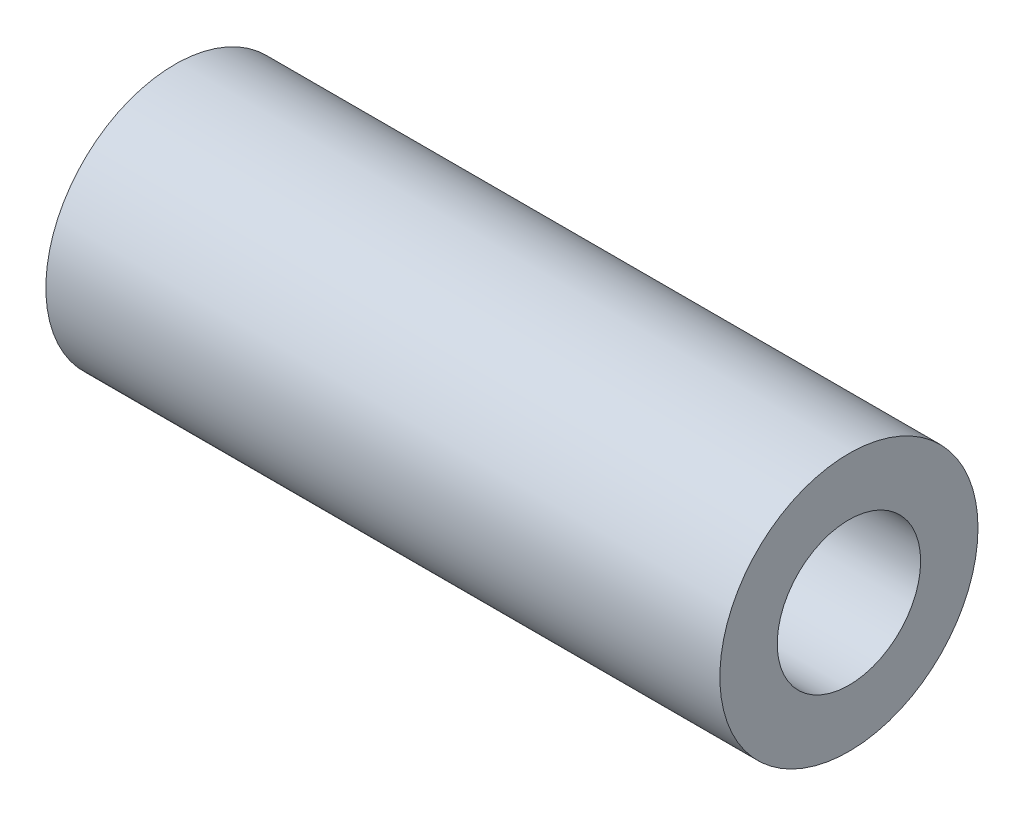
from build123d import *

# Parameters (mm, degrees)
SKETCH1_R           = 4.5
SKETCH1_R_2         = 2.5
BOSS_EXTRUDE1_DEPTH = 23.5


with BuildPart() as part:
    # Sketch1 → Boss-Extrude1 (new body)
    with BuildSketch(Plane(origin=(0, 0, 0), x_dir=(0, 0, -1), z_dir=(1, 0, 0))):
        Circle(SKETCH1_R)
        Circle(SKETCH1_R_2, mode=Mode.SUBTRACT)
    extrude(amount=BOSS_EXTRUDE1_DEPTH)


solid = part.part
